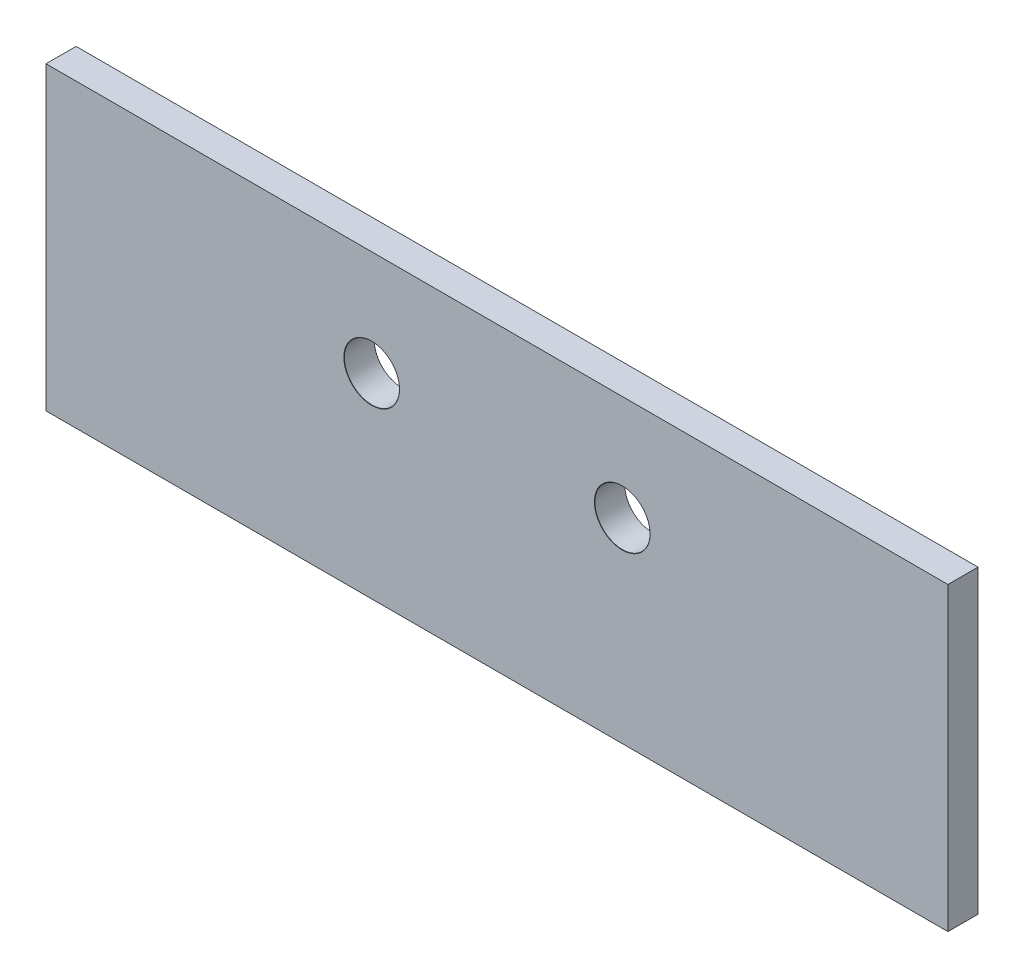
from build123d import *

# Parameters (mm, degrees)
SKETCH1_W                      = 90
SKETCH1_H                      = 30
BOSS_EXTRUDE1_DEPTH            = 1.5
M5_CLEARANCE_HOLE1_D           = 5.5
M5_CLEARANCE_HOLE1_CSINK_D     = 5.55
M5_CLEARANCE_HOLE1_CSINK_ANGLE = 90


with BuildPart() as part:
    # Sketch1 → Boss-Extrude1 (new, symmetric)
    with BuildSketch(Plane.XY):
        Rectangle(SKETCH1_W, SKETCH1_H)
    extrude(amount=BOSS_EXTRUDE1_DEPTH, both=True)

    # M5 Clearance Hole1 (through all)
    with Locations(Plane.XY.offset(1.5)):
        with Locations((12.5, 4.5), (-12.5, 4.5)):
            CounterSinkHole(M5_CLEARANCE_HOLE1_D / 2, M5_CLEARANCE_HOLE1_CSINK_D / 2, counter_sink_angle=M5_CLEARANCE_HOLE1_CSINK_ANGLE)


solid = part.part
